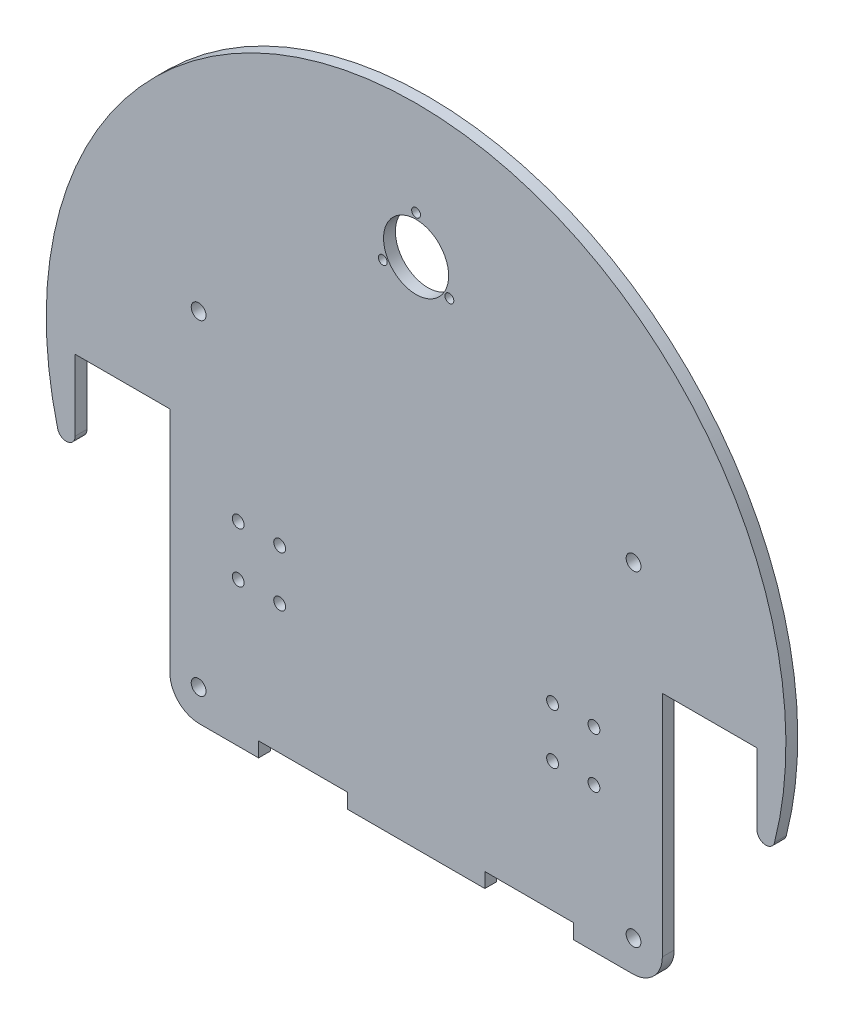
from build123d import *

# Parameters (mm, degrees)
SKETCH1_R           = 11
BOSS_EXTRUDE1_DEPTH = 4
SKETCH2_R           = 1.5
CUT_EXTRUDE1_DEPTH  = 10
CUT_EXTRUDE2_START  = -10
CUT_EXTRUDE2_DEPTH  = 10
FILLET1_R           = 10
FILLET3_R           = 3
SKETCH5_W           = 30
SKETCH5_H           = 5
CUT_EXTRUDE4_DEPTH  = 10
SKETCH6_R           = 2.5
CUT_EXTRUDE5_DEPTH  = 177.821944339
SKETCH8_R           = 2
CUT_EXTRUDE7_DEPTH  = 177.821944339


with BuildPart() as part:
    # Sketch1 → Boss-Extrude1 (new body)
    with BuildSketch(Plane.XY):
        with BuildLine():
            Line((-115.233797414, -48.437298991), (-115.233797414, -6.093952298))
            Line((-115.233797414, -6.093952298), (-83.233797414, -6.093952298))
            Line((-83.233797414, -6.093952298), (-83.233797414, -93.258431083))
            ThreePointArc((-83.233797414, -93.258431083), (0, -125), (83.233797414, -93.258431083))
            Line((83.233797414, -93.258431083), (83.233797414, -6.093952298))
            Line((83.233797414, -6.093952298), (115.233797414, -6.093952298))
            Line((115.233797414, -6.093952298), (115.233797414, -48.437298991))
            ThreePointArc((115.233797414, -48.437298991), (0, 125), (-115.233797414, -48.437298991))
        make_face()
        with Locations((0, 80)):
            Circle(SKETCH1_R, mode=Mode.SUBTRACT)
    extrude(amount=BOSS_EXTRUDE1_DEPTH)

    # Sketch2 → Cut-Extrude1 (cut)
    with BuildSketch(Plane.XY.offset(4)):
        with Locations((0, 92.990381057)):
            Circle(SKETCH2_R)
        with Locations((11.25, 73.504809472)):
            Circle(SKETCH2_R)
        with Locations((-11.25, 73.504809472)):
            Circle(SKETCH2_R)
    extrude(amount=-CUT_EXTRUDE1_DEPTH, mode=Mode.SUBTRACT)

    # Sketch3 → Cut-Extrude2 (cut)
    with BuildSketch(Plane.XY.offset(4).offset(CUT_EXTRUDE2_START)):
        with BuildLine():
            Line((-83.233797414, -93.258431083), (83.233797414, -93.258431083))
            ThreePointArc((83.233797414, -93.258431083), (0, -125), (-83.233797414, -93.258431083))
        make_face()
    extrude(amount=CUT_EXTRUDE2_DEPTH, mode=Mode.SUBTRACT)

    # Fillet1
    fillet1_edges = [part.edges().sort_by_distance(p)[0] for p in [
        (83.233797414, -93.258431083, 2),
        (-83.233797414, -93.258431083, 2),
    ]]
    fillet(fillet1_edges, radius=FILLET1_R)

    # Fillet3
    fillet3_edges = [part.edges().sort_by_distance(p)[0] for p in [
        (115.233797414, -48.437298991, 2),
        (-115.233797414, -48.437298991, 2),
    ]]
    fillet(fillet3_edges, radius=FILLET3_R)

    # Sketch5 → Cut-Extrude4 (cut)
    with BuildSketch(Plane.XY.offset(4)):
        with Locations((38.233797414, -90.758431083)):
            Rectangle(SKETCH5_W, SKETCH5_H)
        with Locations((-38.233797414, -90.758431083)):
            Rectangle(SKETCH5_W, SKETCH5_H)
    extrude(amount=-CUT_EXTRUDE4_DEPTH, mode=Mode.SUBTRACT)

    # Sketch6 → Cut-Extrude5 (cut, through all)
    with BuildSketch(Plane.XY.offset(4)):
        with Locations((-73.5, -82.645466924)):
            Circle(SKETCH6_R)
        with Locations((73.5, -82.645466924)):
            Circle(SKETCH6_R)
        with Locations((73.5, 27.354533076)):
            Circle(SKETCH6_R)
        with Locations((-73.5, 27.354533076)):
            Circle(SKETCH6_R)
    extrude(amount=-CUT_EXTRUDE5_DEPTH, mode=Mode.SUBTRACT)

    # Sketch8 → Cut-Extrude7 (cut, through all)
    with BuildSketch(Plane.XY.offset(4)):
        with Locations((46.115537646, -27.497588789)):
            Circle(SKETCH8_R)
        with Locations((46.115537646, -44.497588789)):
            Circle(SKETCH8_R)
        with Locations((60.115537646, -44.497588789)):
            Circle(SKETCH8_R)
        with Locations((60.115537646, -27.497588789)):
            Circle(SKETCH8_R)
    cut_extrude7 = extrude(amount=-CUT_EXTRUDE7_DEPTH, mode=Mode.SUBTRACT)

    # Mirror2: Cut-Extrude7 across plane
    add(cut_extrude7.mirror(Plane.ZY), mode=Mode.SUBTRACT)


solid = part.part
